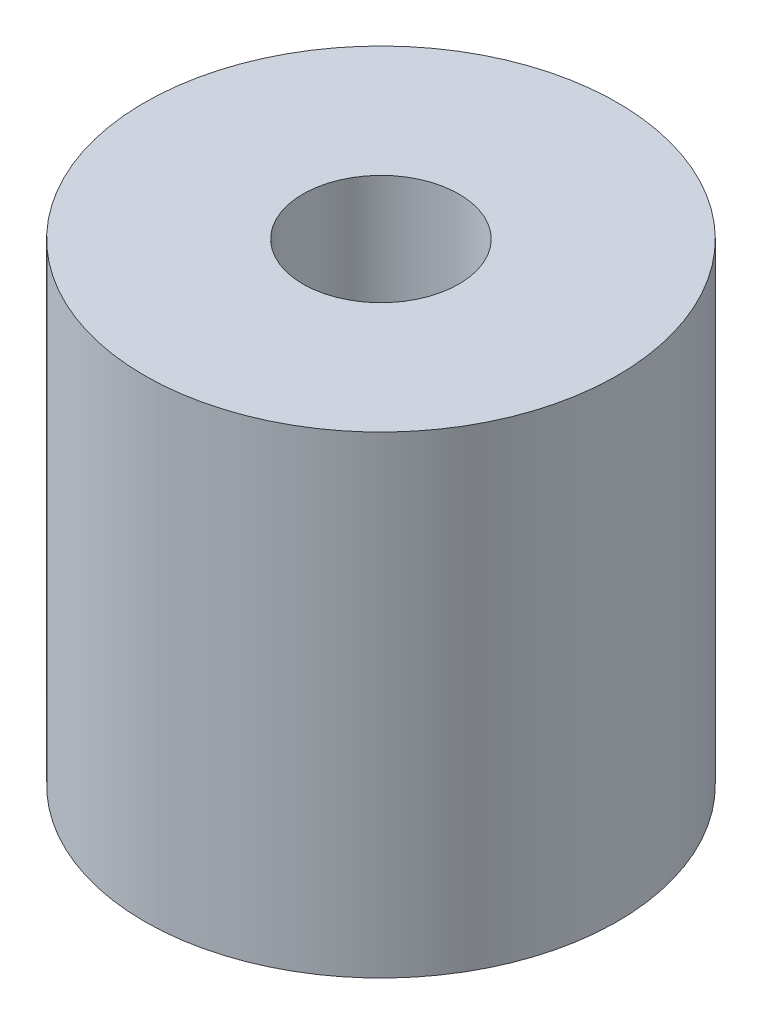
from build123d import *

# Parameters (mm, degrees)
SKETCH_1_R      = 5
SKETCH_1_R_2    = 1.65
EXTRUDE_1_DEPTH = 10


with BuildPart() as part:
    # ｽｹｯﾁ1 → ﾎﾞｽ - 押し出し1 (new body)
    with BuildSketch(Plane(origin=(0, 0, 0), x_dir=(1, 0, 0), z_dir=(0, 1, 0))):
        with Locations(Location((0, 0, 0), (0, 0, 270))):
            Circle(SKETCH_1_R)
        with Locations(Location((0, 0, 0), (0, 0, 270))):
            Circle(SKETCH_1_R_2, mode=Mode.SUBTRACT)
    extrude(amount=EXTRUDE_1_DEPTH)


solid = part.part
